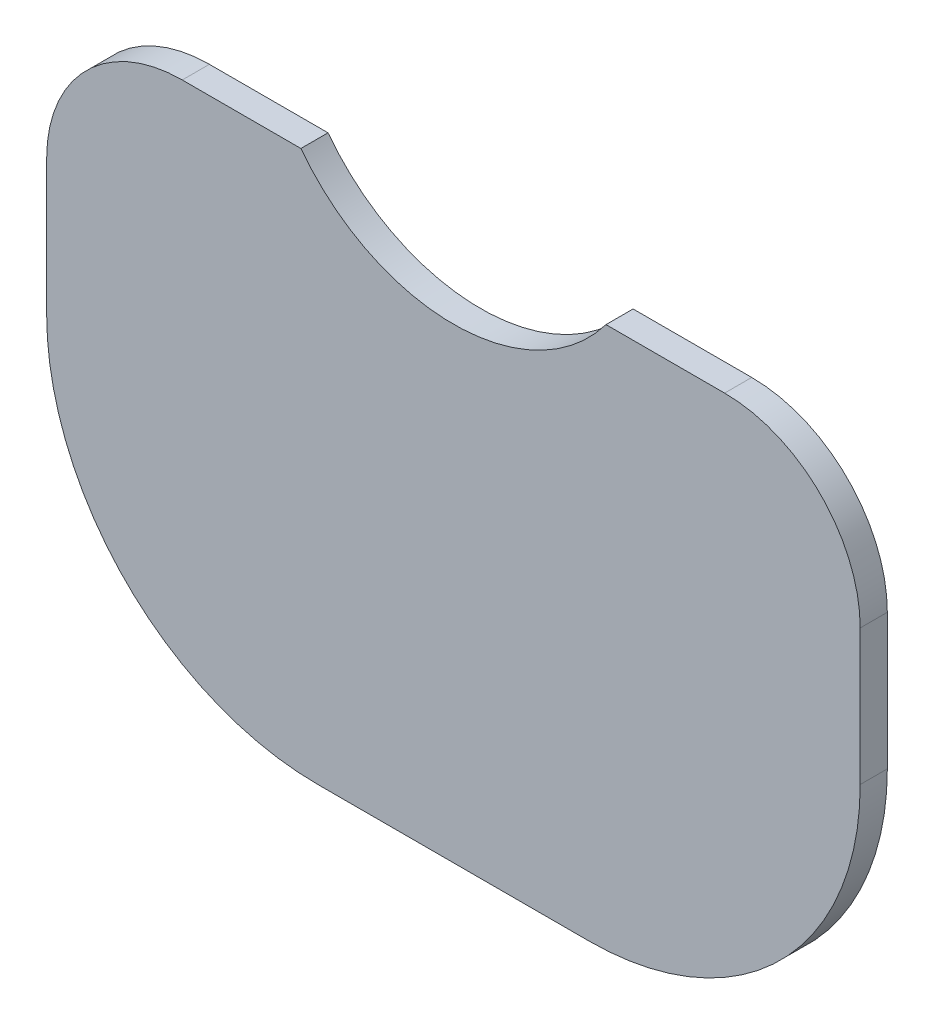
from build123d import *

# Parameters (mm, degrees)
EXTRUDE_1_DEPTH = 2
SKETCH_3_R      = 7.5
EXTRUDE_2_DEPTH = 6.5


with BuildPart() as part:
    # 草图1 → 凸台-拉伸1 (new body)
    with BuildSketch(Plane.XY):
        with BuildLine():
            Line((-10, -20), (10, -20))
            ThreePointArc((10, -20), (24.142135624, -14.142135624), (30, 0))
            Line((30, 0), (30, 10))
            ThreePointArc((30, 10), (27.071067812, 17.071067812), (20, 20))
            Line((20, 20), (11.249888888, 20))
            ThreePointArc((11.249888888, 20), (0, 14.4), (-11.249888888, 20))
            Line((-11.249888888, 20), (-20, 20))
            ThreePointArc((-20, 20), (-27.071067812, 17.071067812), (-30, 10))
            Line((-30, 10), (-30, 0))
            ThreePointArc((-30, 0), (-24.142135624, -14.142135624), (-10, -20))
        make_face()
    extrude(amount=EXTRUDE_1_DEPTH)

    # 草图3 → 凸台-拉伸2 (add)
    with BuildSketch(Plane.XY):
        with Locations((-12.5, 0)):
            Circle(SKETCH_3_R)
        with Locations((12.5, 0)):
            Circle(SKETCH_3_R)
    extrude(amount=-EXTRUDE_2_DEPTH)


solid = part.part
